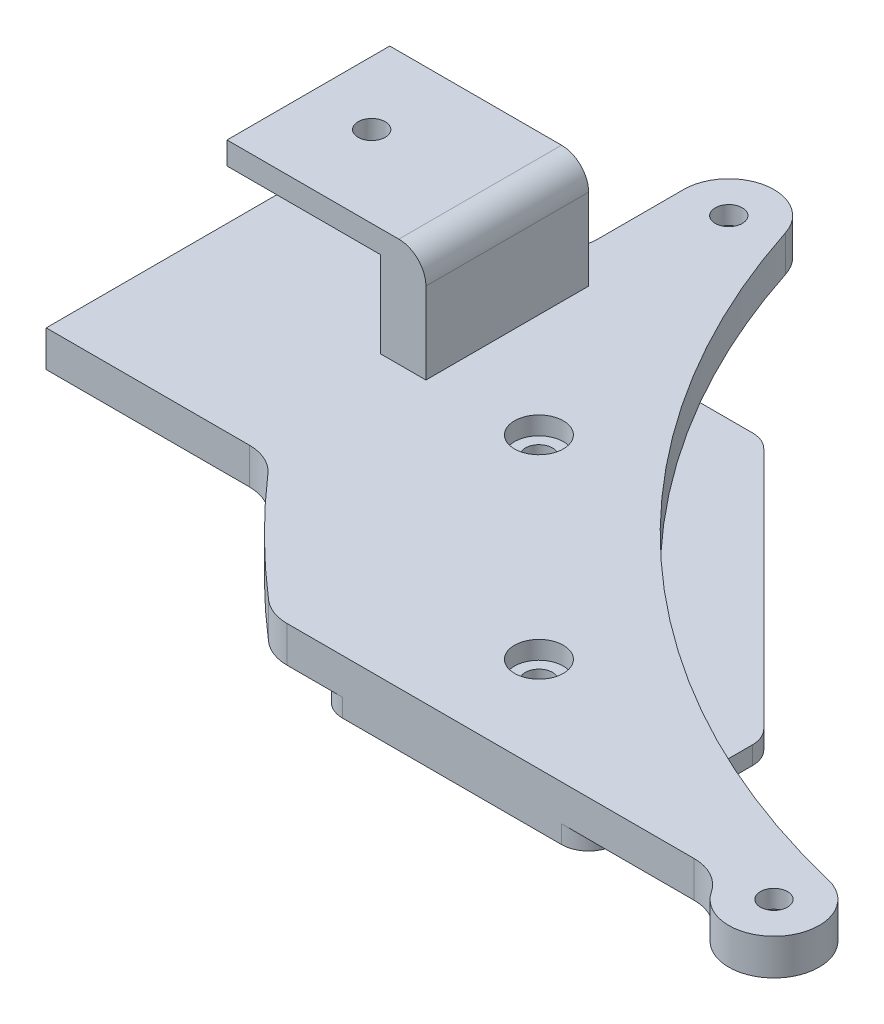
from build123d import *

# Parameters (mm, degrees)
SALIENTE_EXTRUIR2_DEPTH = 2
CROQUIS4_R              = 1.5
SALIENTE_EXTRUIR3_DEPTH = 4
CROQUIS6_R              = 1.5
CORTAR_EXTRUIR1_DEPTH   = 44
CROQUIS7_R              = 2.7
CORTAR_EXTRUIR2_DEPTH   = 2
CORTAR_EXTRUIR3_DEPTH   = 2
CORTAR_EXTRUIR4_DEPTH   = 2
CROQUIS10_W             = 5
CROQUIS10_H             = 18
SALIENTE_EXTRUIR4_DEPTH = 2
SALIENTE_EXTRUIR5_DEPTH = 18
CROQUIS12_R             = 1.5
CORTAR_EXTRUIR5_DEPTH   = 5


with BuildPart() as part:
    # Croquis1 → Saliente-Extruir2 (new body)
    with BuildSketch(Plane(origin=(0, 0, 0), x_dir=(1, 0, 0), z_dir=(0, 1, 0))):
        with BuildLine():
            Line((3, 48), (18.129942315, 48))
            ThreePointArc((18.129942315, 48), (19.277992612, 47.771638598), (20.251262658, 47.121320344))
            Line((20.251262658, 47.121320344), (47.121320344, 20.251262658))
            ThreePointArc((47.121320344, 20.251262658), (47.771638598, 19.277992612), (48, 18.129942315))
            Line((48, 18.129942315), (48, 3))
            ThreePointArc((48, 3), (47.121320344, 0.878679656), (45, 0))
            Line((45, 0), (20.784609691, 0))
            ThreePointArc((20.784609691, 0), (18.820648679, 0.732213162), (17.815379735, 2.571428571))
            ThreePointArc((17.815379735, 2.571428571), (12.727922061, 12.727922061), (2.571428571, 17.815379735))
            ThreePointArc((2.571428571, 17.815379735), (0.732213162, 18.820648679), (0, 20.784609691))
            Line((0, 20.784609691), (0, 45))
            ThreePointArc((0, 45), (0.878679656, 47.121320344), (3, 48))
        make_face()
    extrude(amount=-SALIENTE_EXTRUIR2_DEPTH)

    # Croquis4 → Saliente-Extruir3 (add)
    with BuildSketch(Plane(origin=(0, 0, 0), x_dir=(1, 0, 0), z_dir=(0, 1, 0))):
        with BuildLine():
            Line((14.648353456, 0), (59.648353456, 0))
            ThreePointArc((59.648353456, 0), (62.020061701, -0.598295785), (63.824176728, -2.25))
            ThreePointArc((63.824176728, -2.25), (72.089608603, -2.37664761), (69.176765452, 5.359549678))
            ThreePointArc((69.176765452, 5.359549678), (29.192462946, 26.810912386), (4.755712821, 65.043760204))
            ThreePointArc((4.755712821, 65.043760204), (-0.781484452, 68.438550602), (-5, 63.5))
            Line((-5, 63.5), (-5, 54))
            ThreePointArc((-5, 54), (-6.464466094, 50.464466094), (-10, 49))
            Line((-10, 49), (-27, 49))
            Line((-27, 49), (-27, 15))
            Line((-27, 15), (-4.533601503, 15))
            ThreePointArc((-4.533601503, 15), (-2.464811146, 14.551934364), (-0.766802335, 13.288042583))
            ThreePointArc((-0.766802335, 13.288042583), (5.094474955, 7.035057245), (11.383817909, 1.212810057))
            ThreePointArc((11.383817909, 1.212810057), (12.907082327, 0.312999375), (14.648353456, 0))
        make_face()
        with Locations(Location((0, 63.5, 0), (0, 0, 270))):
            Circle(CROQUIS4_R, mode=Mode.SUBTRACT)
        with Locations(Location((68, 0.5, 0), (0, 0, 270))):
            Circle(CROQUIS4_R, mode=Mode.SUBTRACT)
    extrude(amount=SALIENTE_EXTRUIR3_DEPTH)

    # Croquis6 → Cortar-Extruir1 (cut)
    with BuildSketch(Plane.XZ.offset(2)):
        with Locations(Location((10.5, -32, 0), (0, 0, 270))):
            Circle(CROQUIS6_R)
        with Locations(Location((32, -10.5, 0), (0, 0, 270))):
            Circle(CROQUIS6_R)
    extrude(amount=-CORTAR_EXTRUIR1_DEPTH, mode=Mode.SUBTRACT)

    # Croquis7 → Cortar-Extruir2 (cut)
    with BuildSketch(Plane(origin=(0, 4, 0), x_dir=(1, 0, 0), z_dir=(0, 1, 0))):
        with Locations(Location((10.5, 32, 0), (0, 0, 270))):
            Circle(CROQUIS7_R)
        with Locations(Location((32, 10.5, 0), (0, 0, 270))):
            Circle(CROQUIS7_R)
    extrude(amount=-CORTAR_EXTRUIR2_DEPTH, mode=Mode.SUBTRACT)

    # Croquis8 → Cortar-Extruir3 (cut)
    with BuildSketch(Plane.XZ):
        Polygon((0, -60.324573519), (-2.75, -61.91228676), (-2.75, -65.08771324), (0, -66.675426481), (2.75, -65.08771324), (2.75, -61.91228676), align=None)
    extrude(amount=-CORTAR_EXTRUIR3_DEPTH, mode=Mode.SUBTRACT)

    # Croquis9 → Cortar-Extruir4 (cut)
    with BuildSketch(Plane.XZ):
        Polygon((64.824573519, -0.5), (66.41228676, -3.25), (69.58771324, -3.25), (71.175426481, -0.5), (69.58771324, 2.25), (66.41228676, 2.25), align=None)
    extrude(amount=-CORTAR_EXTRUIR4_DEPTH, mode=Mode.SUBTRACT)

    # Croquis10 → Saliente-Extruir4 (add)
    with BuildSketch(Plane(origin=(0, 4, 0), x_dir=(1, 0, 0), z_dir=(0, 1, 0))):
        with Locations((-3.5, 40)):
            Rectangle(CROQUIS10_W, CROQUIS10_H)
    extrude(amount=SALIENTE_EXTRUIR4_DEPTH)

    # Croquis11 → Saliente-Extruir5 (add)
    with BuildSketch(Plane.XY.offset(-31)):
        with BuildLine():
            Line((-6, 4), (-6, 13.5))
            Line((-6, 13.5), (-23, 13.5))
            Line((-23, 13.5), (-23, 16))
            Line((-23, 16), (-4, 16))
            ThreePointArc((-4, 16), (-1.878679656, 15.121320344), (-1, 13))
            Line((-1, 13), (-1, 4))
            Line((-1, 4), (-6, 4))
        make_face()
    extrude(amount=-SALIENTE_EXTRUIR5_DEPTH)

    # Croquis12 → Cortar-Extruir5 (cut)
    with BuildSketch(Plane(origin=(0, 16, 0), x_dir=(1, 0, 0), z_dir=(0, 1, 0))):
        with Locations(Location((-16, 40, 0), (0, 0, 270))):
            Circle(CROQUIS12_R)
    extrude(amount=-CORTAR_EXTRUIR5_DEPTH, mode=Mode.SUBTRACT)


solid = part.part
